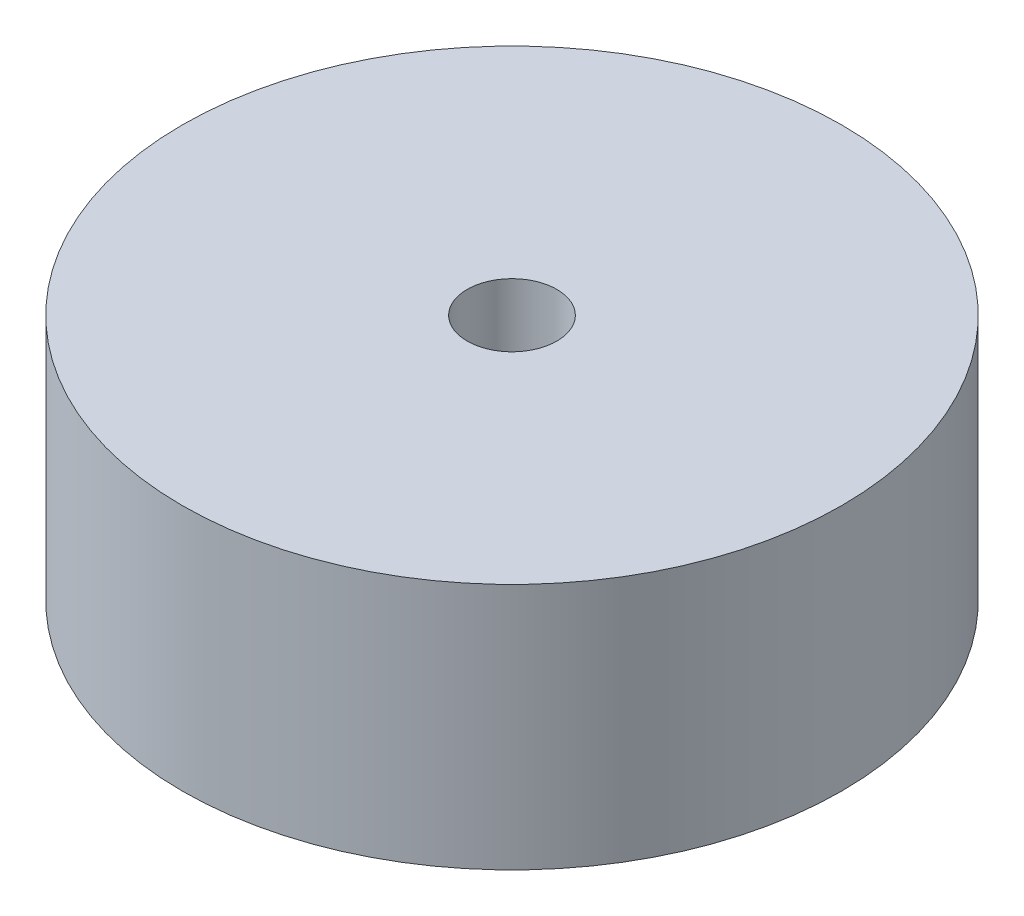
from build123d import *

# Parameters (mm, degrees)
SKETCH1_R                = 25.4
BOSS_EXTRUDE1_DEPTH      = 19.05
F_5_16_24_TAPPED_HOLE1_D = 6.9088


with BuildPart() as part:
    # Sketch1 → Boss-Extrude1 (new body)
    with BuildSketch(Plane(origin=(0, 0, 0), x_dir=(1, 0, 0), z_dir=(0, 1, 0))):
        with Locations(Location((0, 0, 0), (0, 0, 90))):
            Circle(SKETCH1_R)
    extrude(amount=BOSS_EXTRUDE1_DEPTH)

    # 5/16-24 Tapped Hole1 (through all)
    with Locations(Plane(origin=(0, 19.05, 0), x_dir=(1, 0, 0), z_dir=(0, 1, 0))):
        with Locations((0, 0)):
            Hole(F_5_16_24_TAPPED_HOLE1_D / 2)


solid = part.part
